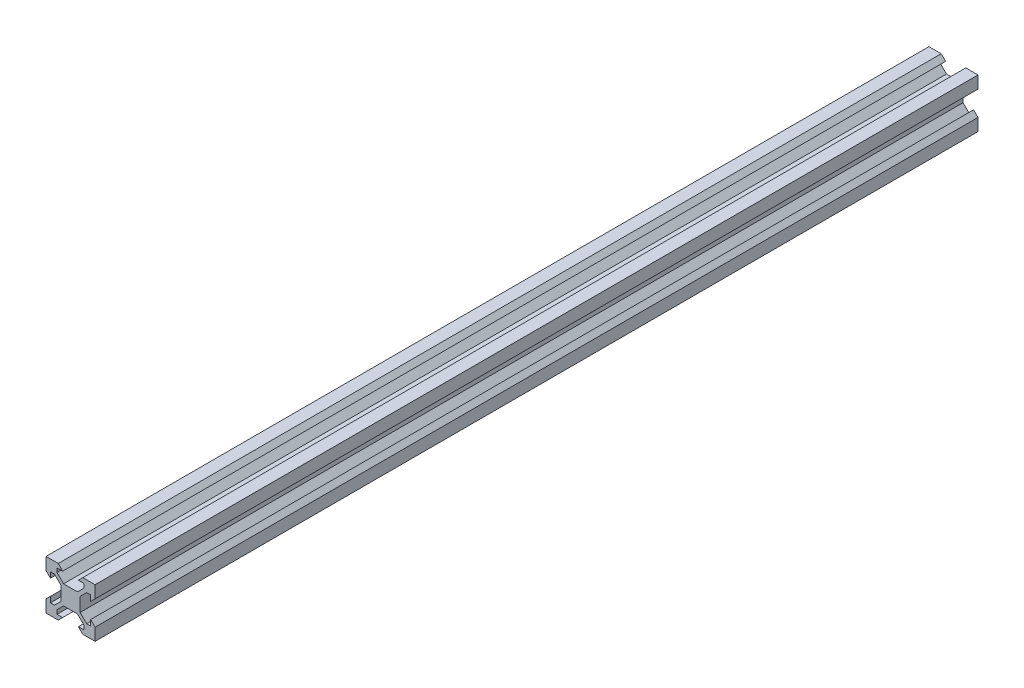
from build123d import *

# Parameters (mm, degrees)
SKETCH1_R           = 2.1
BOSS_EXTRUDE1_DEPTH = 340
EXTRUDE_1_DEPTH     = 20


with BuildPart() as part:
    # Sketch1 → Boss-Extrude1 (new body)
    with BuildSketch(Plane.XY):
        Polygon((-10, 10), (-10, 5), (-8.2, 3.2), (-8.2, 5.499339828), (-6.56, 5.499339828), (-3.900660172, 2.84), (-3.900660172, -2.84), (-6.56, -5.499339828), (-8.2, -5.499339828), (-8.2, -3.2), (-10, -5), (-10, -10), (-5, -10), (-3.2, -8.2), (-5.499339828, -8.2), (-5.499339828, -6.56), (-2.84, -3.900660172), (2.84, -3.900660172), (5.499339828, -6.56), (5.499339828, -8.2), (3.2, -8.2), (5, -10), (10, -10), (10, -5), (8.2, -3.2), (8.2, -5.499339828), (6.56, -5.499339828), (3.900660172, -2.84), (3.900660172, 2.84), (6.56, 5.499339828), (8.2, 5.499339828), (8.2, 3.2), (10, 5), (10, 10), (5, 10), (3.2, 8.2), (5.499339828, 8.2), (5.499339828, 6.56), (2.84, 3.900660172), (-2.84, 3.900660172), (-5.499339828, 6.56), (-5.499339828, 8.2), (-3.2, 8.2), (-5, 10), align=None)
        Circle(SKETCH1_R, mode=Mode.SUBTRACT)
    extrude(amount=-BOSS_EXTRUDE1_DEPTH)

    # 草图1 → 凸台-拉伸1 (add)
    with BuildSketch(Plane.XY):
        Polygon((-5, 10), (-10, 10), (-10, 5), (-8.2, 3.2), (-8.2, 5.499339828), (-6.56, 5.499339828), (-3.900660172, 2.84), (-3.900660172, -2.84), (-6.56, -5.499339828), (-8.2, -5.499339828), (-8.2, -3.2), (-10, -5), (-10, -10), (-5, -10), (-3.2, -8.2), (-5.499339828, -8.2), (-5.499339828, -6.56), (-2.84, -3.900660172), (2.84, -3.900660172), (5.499339828, -6.56), (5.499339828, -8.2), (3.2, -8.2), (5, -10), (10, -10), (10, -5), (8.2, -3.2), (8.2, -5.499339828), (6.56, -5.499339828), (3.900660172, -2.84), (3.900660172, 2.84), (6.56, 5.499339828), (8.2, 5.499339828), (8.2, 3.2), (10, 5), (10, 10), (5, 10), (3.2, 8.2), (5.499339828, 8.2), (5.499339828, 6.56), (2.84, 3.900660172), (-2.84, 3.900660172), (-5.499339828, 6.56), (-5.499339828, 8.2), (-3.2, 8.2), align=None)
    extrude(amount=EXTRUDE_1_DEPTH)


solid = part.part
